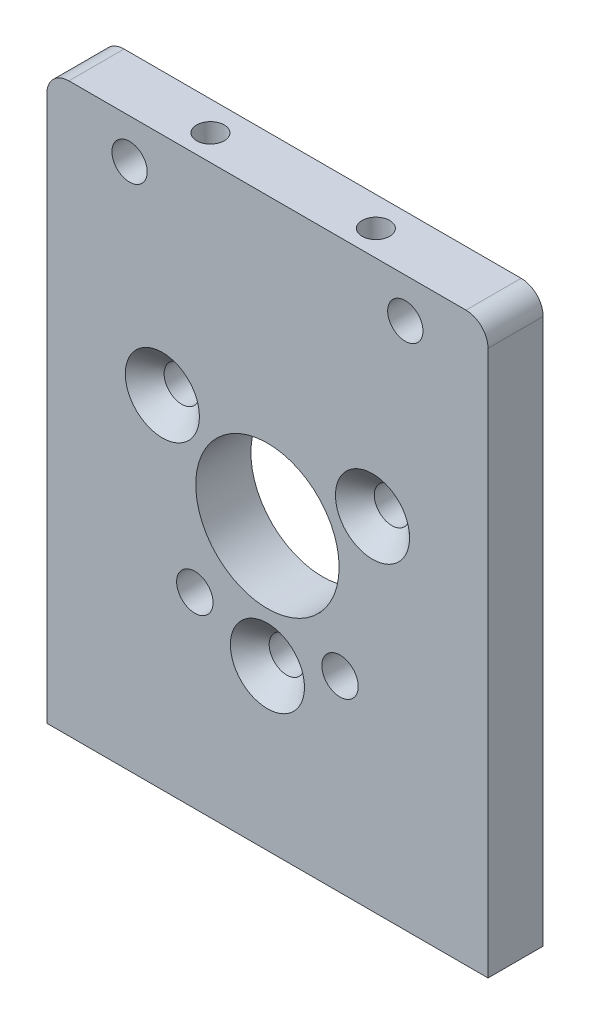
from build123d import *

# Parameters (mm, degrees)
SKETCH1_W                     = 40
SKETCH1_H                     = 51.440769906
SKETCH1_R                     = 6.5
SKETCH1_R_2                   = 1.6
BOSS_EXTRUDE1_DEPTH           = 5
M4X0_7_TAPPED_HOLE1_D         = 3.3
CSK_FOR_M3_SFHCS1_D           = 3.2
CSK_FOR_M3_SFHCS1_CSINK_D     = 6.72
CSK_FOR_M3_SFHCS1_CSINK_ANGLE = 90
FILLET1_R                     = 2
M3X0_5_TAPPED_HOLE1_D         = 2.5
M3X0_5_TAPPED_HOLE1_DEPTH     = 16
M3X0_5_TAPPED_HOLE1_TIP       = 0.751075774
LPATTERN1_COUNT               = 2
LPATTERN1_PITCH               = 15


with BuildPart() as part:
    # Sketch1 → Boss-Extrude1 (new body)
    with BuildSketch(Plane.XY):
        with Locations((0, 25.720384953)):
            Rectangle(SKETCH1_W, SKETCH1_H)
        with Locations((0, 25.5)):
            Circle(SKETCH1_R, mode=Mode.SUBTRACT)
        with Locations((0, 14.5)):
            Circle(SKETCH1_R_2, mode=Mode.SUBTRACT)
        with Locations((-9.526279442, 31)):
            Circle(SKETCH1_R_2, mode=Mode.SUBTRACT)
        with Locations((9.526279442, 31)):
            Circle(SKETCH1_R_2, mode=Mode.SUBTRACT)
        with Locations((-12.5, 47.840769906)):
            Circle(SKETCH1_R_2, mode=Mode.SUBTRACT)
        with Locations((12.5, 47.840769906)):
            Circle(SKETCH1_R_2, mode=Mode.SUBTRACT)
    extrude(amount=BOSS_EXTRUDE1_DEPTH)

    # M4x0.7 Tapped Hole1 (through all)
    with Locations(Plane(origin=(0, 0, 0), x_dir=(-1, 0, 0), z_dir=(0, 0, -1))):
        with Locations((-6.581223291, 17), (6.581223291, 17)):
            Hole(M4X0_7_TAPPED_HOLE1_D / 2)

    # CSK for M3 SFHCS1 (through all)
    with Locations(Plane.XY.offset(5)):
        with Locations((-9.526279442, 31), (9.526279442, 31), (0, 14.5)):
            CounterSinkHole(CSK_FOR_M3_SFHCS1_D / 2, CSK_FOR_M3_SFHCS1_CSINK_D / 2, counter_sink_angle=CSK_FOR_M3_SFHCS1_CSINK_ANGLE)

    # Fillet1
    fillet1_edges = [part.edges().sort_by_distance(p)[0] for p in [
        (-20, 51.440769906, 2.5),
        (20, 51.440769906, 2.5),
    ]]
    fillet(fillet1_edges, radius=FILLET1_R)

    # M3x0.5 Tapped Hole1
    with Locations(Plane.XZ):
        with Locations((-16, 2.5), (16, 2.5)):
            Hole(M3X0_5_TAPPED_HOLE1_D / 2, depth=M3X0_5_TAPPED_HOLE1_DEPTH)
            with Locations((0, 0, -(M3X0_5_TAPPED_HOLE1_DEPTH + M3X0_5_TAPPED_HOLE1_TIP / 2))):  # 118° drill point
                Cone(0, M3X0_5_TAPPED_HOLE1_D / 2, M3X0_5_TAPPED_HOLE1_TIP, mode=Mode.SUBTRACT)

    # Sketch34 → M3 Tapped Hole1 (revolve, cut)
    with BuildSketch(Plane(origin=(7.5, 51.440769906, 2.667636596), x_dir=(0, 0, 1), z_dir=(1, 0, 0))):
        Polygon((0, 0), (0, 6), (1.25, 5.248924226), (1.25, 0), align=None)
    m3_tapped_hole1 = revolve(axis=Axis((7.5, 57.790769906, 2.667636596), (0, -1, 0)), mode=Mode.SUBTRACT)

    # LPattern1: M3 Tapped Hole1 ×2
    with Locations(*[(-i * LPATTERN1_PITCH, 0, 0) for i in range(1, LPATTERN1_COUNT)]):
        add(m3_tapped_hole1, mode=Mode.SUBTRACT)


solid = part.part
